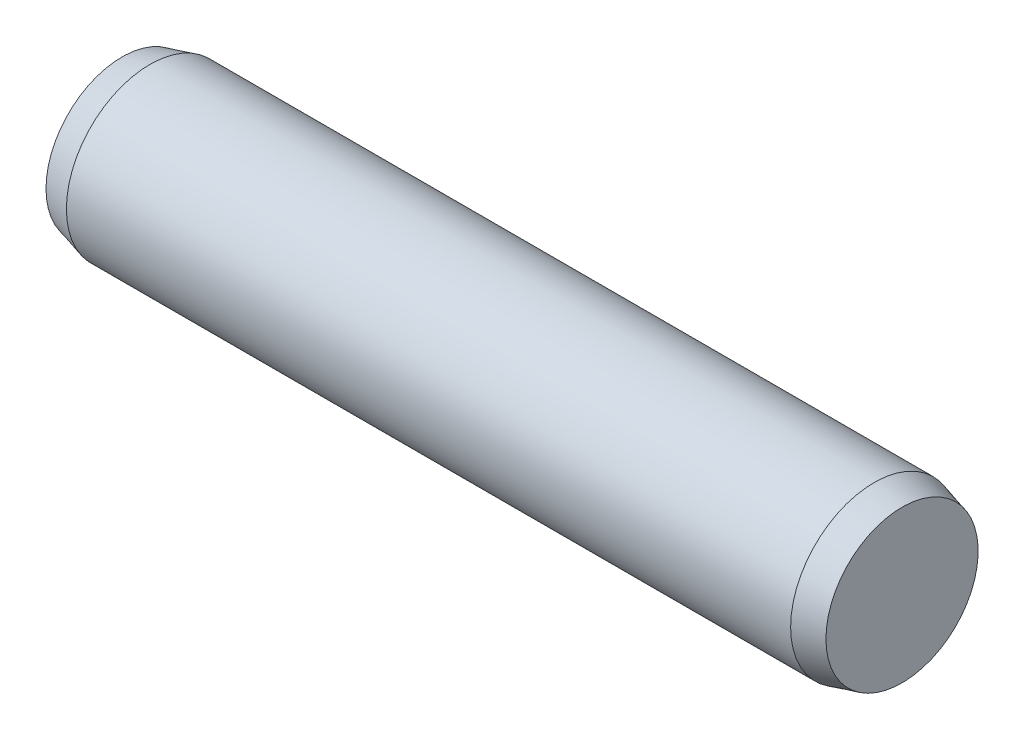
from build123d import *


with BuildPart() as part:
    # Sketch1 → Base-Revolve (revolve)
    with BuildSketch(Plane.XY, mode=Mode.PRIVATE) as base_revolve_sk:
        Polygon((0, 0), (14, 0), (14, 1.366025404), (13.5, 1.5), (0.5, 1.5), (0, 1.366025404), align=None)
    revolve(base_revolve_sk.sketch.rotate(Axis((-1.655717266, 0, 0), (1, 0, 0)), 90), axis=Axis((-1.655717266, 0, 0), (1, 0, 0)))


solid = part.part
